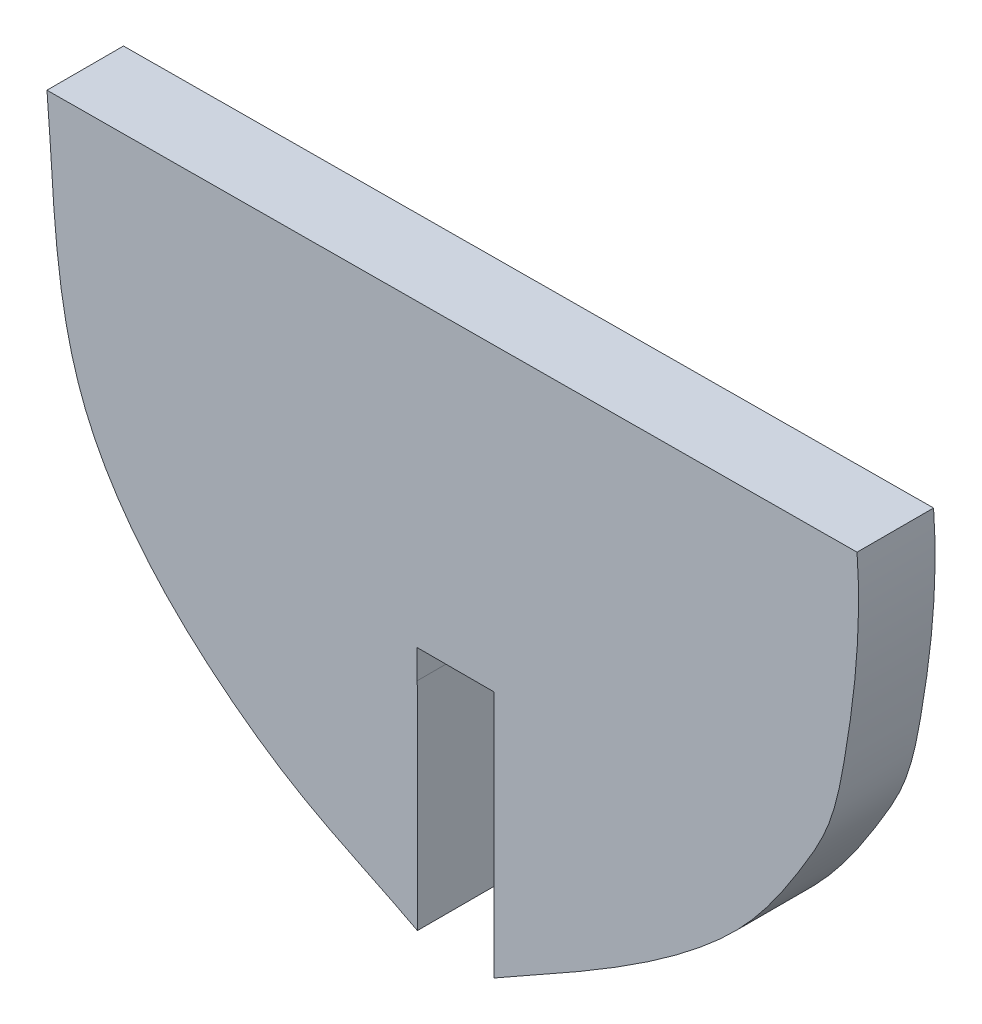
from build123d import *

# Parameters (mm, degrees)
EXTRUDE_1_DEPTH = 8


with BuildPart() as part:
    # 草图1 → 凸台-拉伸1 (new body)
    with BuildSketch(Plane.XY):
        with BuildLine():
            Line((9.884140627, 48.890967478), (9.862592606, 71.797167618))
            Line((9.862592606, 71.797167618), (9.862592606, 74.789638905))
            Line((9.862592606, 74.789638905), (1.859342158, 74.789638905))
            Line((1.859342158, 74.789638905), (1.859342158, 71.789638905))
            Line((1.859342158, 71.789638905), (1.880609299, 49.182021359))
            add(Edge.make_bspline(
                [(1.880609299, 49.182021359), (-2.147543525, 51.320103541), (-9.368620539, 54.40588996), (-18.684466246, 60.920686929), (-26.75654301, 68.367940859), (-36.33720868, 82.740540116), (-36.066485806, 97.042827626), (-36.847635358, 105.899002406)],
                knots=[0, 0, 0, 0, 0.18493282, 0.316628253, 0.458400557, 0.629057108, 1, 1, 1, 1], degree=3))
            Line((-36.847635358, 105.899002406), (47.833660698, 106.415821201))
            add(Edge.make_bspline(
                [(47.833660698, 106.415821201), (48.319473241, 99.869034947), (47.370463287, 91.039903293), (45.267329493, 80.35246618), (41.497074055, 73.927784135), (37.087778724, 67.31022324), (26.486440292, 57.93257211), (16.797369064, 52.799383097), (9.884140627, 48.890967478)],
                knots=[0, 0, 0, 0, 0.262570007, 0.359675169, 0.434109376, 0.560787033, 0.678988213, 1, 1, 1, 1], degree=3))
        make_face()
    extrude(amount=EXTRUDE_1_DEPTH)


solid = part.part
